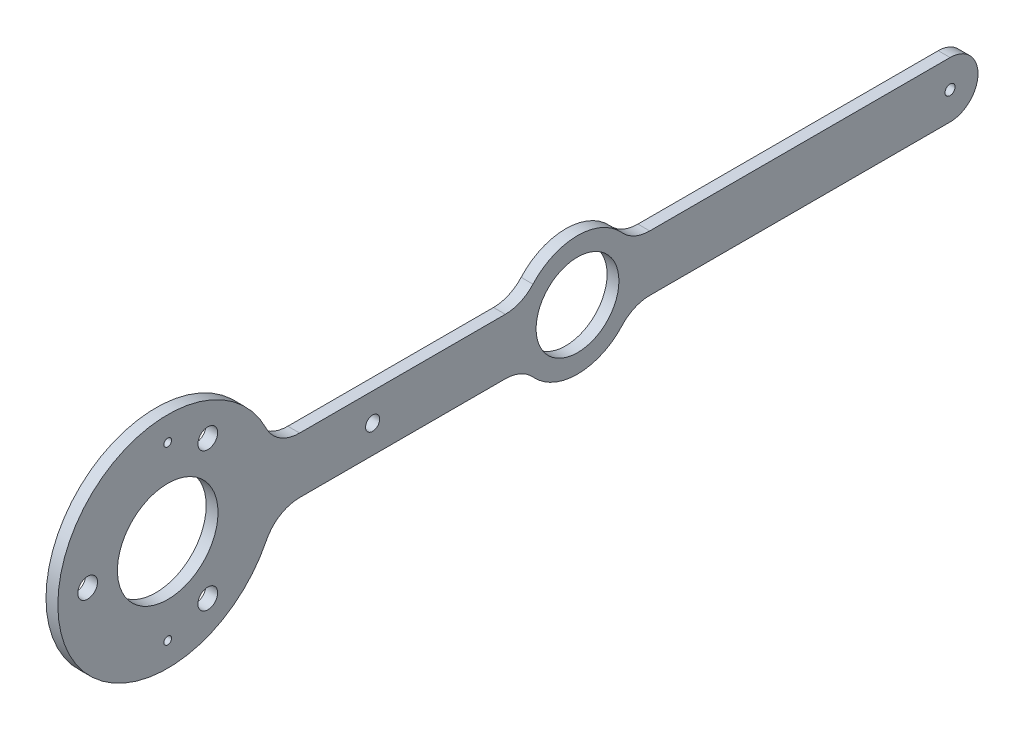
from build123d import *

# Parameters (mm, degrees)
SKETCH1_R                = 13.5
SKETCH1_R_2              = 2.65
SKETCH1_R_3              = 11.1125
BOSS_EXTRUDE1_DEPTH      = 3.175
M2_5X0_45_TAPPED_HOLE1_D = 2.05
F_6_CLEARANCE_HOLE1_D    = 3.7973
F_6_32_TAPPED_HOLE1_D    = 2.7051
FILLET1_R                = 10


with BuildPart() as part:
    # Sketch1 → Boss-Extrude1 (new body)
    with BuildSketch(Plane(origin=(0, 0, 0), x_dir=(0, 0, -1), z_dir=(1, 0, 0))):
        with BuildLine():
            ThreePointArc((-81.469314765, 7.5), (-139.5, 0), (-81.469314765, -7.5))
            Line((-81.469314765, -7.5), (-14.260527909, -7.5))
            ThreePointArc((-14.260527909, -7.5), (0, -16.1125), (14.260527909, -7.5))
            Line((14.260527909, -7.5), (100, -7.5))
            ThreePointArc((100, -7.5), (107.5, 0), (100, 7.5))
            Line((100, 7.5), (14.260527909, 7.5))
            ThreePointArc((14.260527909, 7.5), (0, 16.1125), (-14.260527909, 7.5))
            Line((-14.260527909, 7.5), (-81.469314765, 7.5))
        make_face()
        with Locations((-110, 0)):
            Circle(SKETCH1_R, mode=Mode.SUBTRACT)
        with Locations((-99.25, -18.619546181)):
            Circle(SKETCH1_R_2, mode=Mode.SUBTRACT)
        with Locations((-131.5, 0)):
            Circle(SKETCH1_R_2, mode=Mode.SUBTRACT)
        with Locations((-99.25, 18.619546181)):
            Circle(SKETCH1_R_2, mode=Mode.SUBTRACT)
        Circle(SKETCH1_R_3, mode=Mode.SUBTRACT)
    extrude(amount=BOSS_EXTRUDE1_DEPTH)

    # M2.5x0.45 Tapped Hole1 (through all)
    with Locations(Plane(origin=(3.175, 0, 0), x_dir=(0, 0, -1), z_dir=(1, 0, 0))):
        with Locations((-110, -23.015), (-110, 23.015)):
            Hole(M2_5X0_45_TAPPED_HOLE1_D / 2)

    # #6 Clearance Hole1 (through all)
    with Locations(Plane(origin=(3.175, 0, 0), x_dir=(0, 0, -1), z_dir=(1, 0, 0))):
        with Locations((-55, 0)):
            Hole(F_6_CLEARANCE_HOLE1_D / 2)

    # #6-32 Tapped Hole1 (through all)
    with Locations(Plane(origin=(3.175, 0, 0), x_dir=(0, 0, -1), z_dir=(1, 0, 0))):
        with Locations((100, 0)):
            Hole(F_6_32_TAPPED_HOLE1_D / 2)

    # Fillet1
    fillet1_edges = [part.edges().sort_by_distance(p)[0] for p in [
        (1.5875, 7.5, 81.469314765),
        (1.5875, 7.5, 14.260527909),
        (1.5875, 7.5, -14.260527909),
        (1.5875, -7.5, -14.260527909),
        (1.5875, -7.5, 14.260527909),
        (1.5875, -7.5, 81.469314765),
    ]]
    fillet(fillet1_edges, radius=FILLET1_R)


solid = part.part
